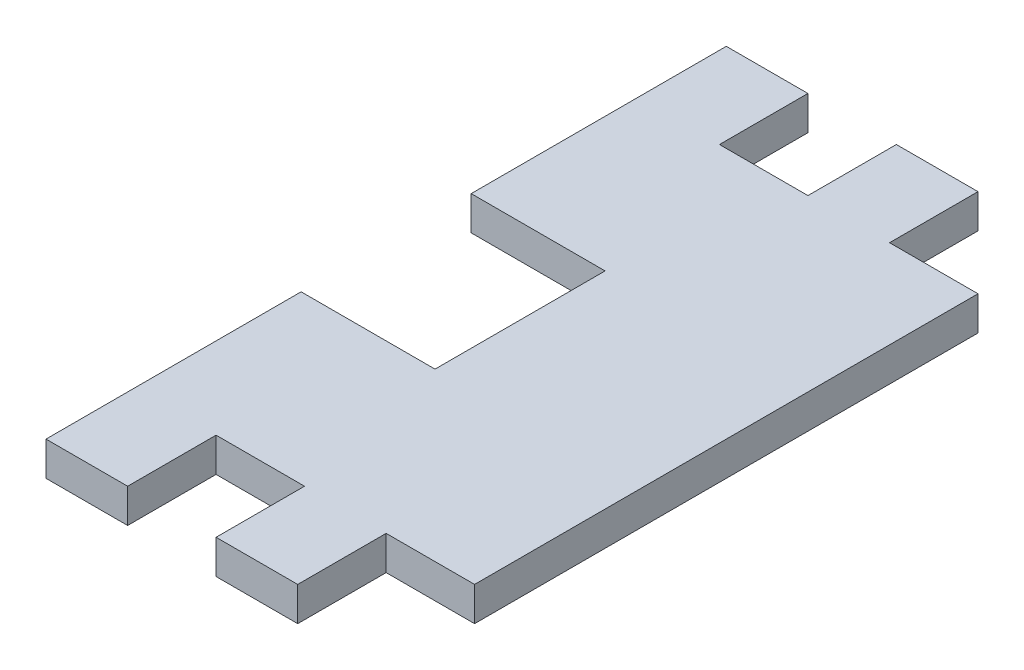
from build123d import *

# Parameters (mm, degrees)
BOSS_EXTRUDE1_DEPTH = 1.27
SKETCH2_W           = 6.604
SKETCH2_H           = 6.604
CUT_EXTRUDE1_DEPTH  = 37.010715072


with BuildPart() as part:
    # Sketch1 → Boss-Extrude1 (new, symmetric)
    with BuildSketch(Plane(origin=(0, 0, 0), x_dir=(1, 0, 0), z_dir=(0, 1, 0))):
        Polygon((0, -25.4), (0, 25.4), (-25.4, 25.4), (-25.4, 6.35), (-15.4, 6.35), (-15.4, -6.35), (-25.4, -6.35), (-25.4, -25.4), align=None)
    extrude(amount=BOSS_EXTRUDE1_DEPTH, both=True)

    # Sketch2 → Cut-Extrude1 (cut, through all)
    with BuildSketch(Plane(origin=(0, 1.27, 0), x_dir=(1, 0, 0), z_dir=(0, 1, 0))):
        with Locations((-3.302, 22.098)):
            Rectangle(SKETCH2_W, SKETCH2_H)
        with Locations((-16.002, 22.098)):
            Rectangle(SKETCH2_W, SKETCH2_H)
        with Locations((-16.002, -22.098)):
            Rectangle(SKETCH2_W, SKETCH2_H)
        with Locations((-3.302, -22.098)):
            Rectangle(SKETCH2_W, SKETCH2_H)
    extrude(amount=-CUT_EXTRUDE1_DEPTH, mode=Mode.SUBTRACT)


solid = part.part
